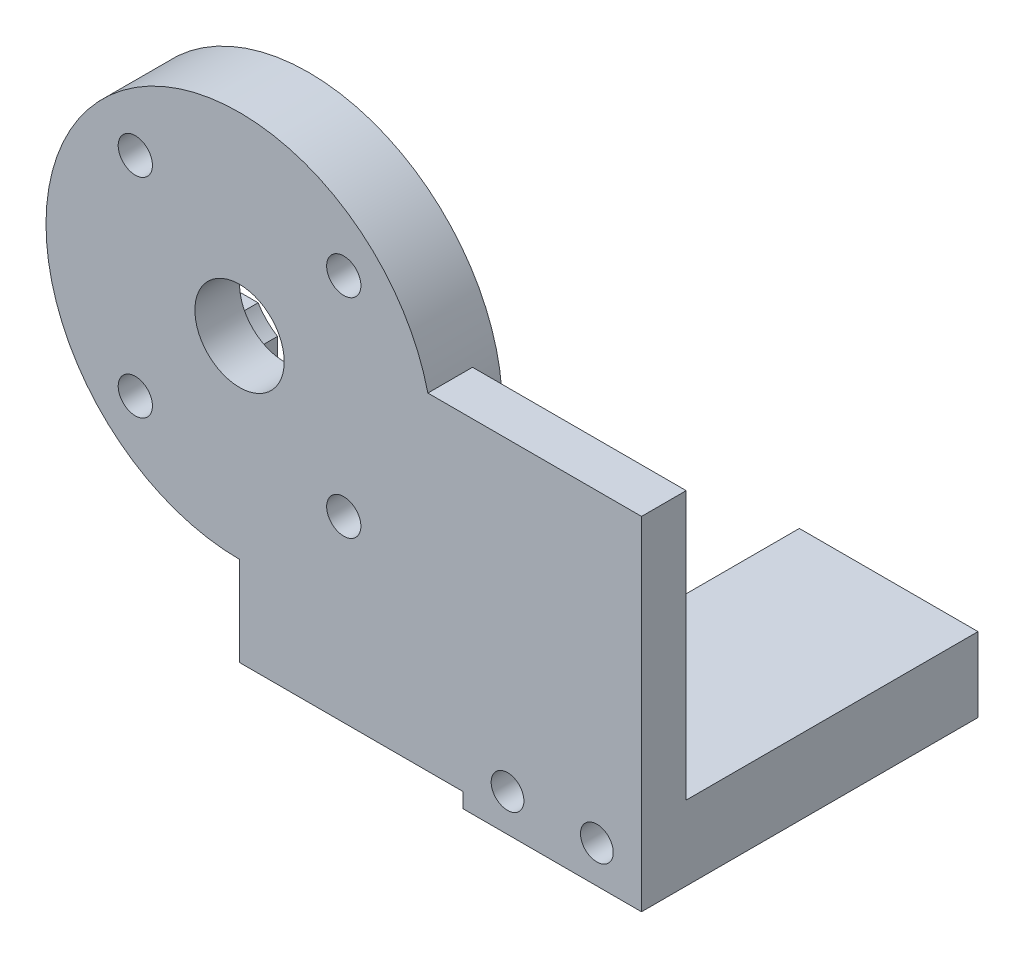
from build123d import *

# Parameters (mm, degrees)
STOCK_HORN_ATTACHMENT_START          = 19.6
STOCK_HORN_ATTACHMENT_PROFILE_R      = 13
STOCK_HORN_ATTACHMENT_DEPTH          = 3
FINGER_ARM_START                     = 19.6
FINGER_ARM_PROFILE_W                 = 27
FINGER_ARM_PROFILE_H                 = 22
FINGER_ARM_DEPTH                     = 3
DESCENDING_CONTACT_FINGER_PROFILE_W  = 12
DESCENDING_CONTACT_FINGER_PROFILE_H  = 5
DESCENDING_CONTACT_FINGER_DEPTH      = 22.6
HORN_CENTER_ACCESS_START             = -50
HORN_CENTER_ACCESS_PROFILE_R         = 3
HORN_CENTER_ACCESS_DEPTH             = 91.493950165
CAPTURED_HORN_KEY_BOSS_START         = 17.95
CAPTURED_HORN_KEY_BOSS_PROFILE_R     = 13
CAPTURED_HORN_KEY_BOSS_DEPTH         = 1.65
KEY_POCKET_HUB_START                 = 17.95
STOCK_HORN_POCKET_HUB_R              = 3.55
KEY_POCKET_HUB_DEPTH                 = 1.65
KEY_POCKET_HORIZONTAL_START          = 17.95
STOCK_HORN_POCKET_HORIZONTAL_W       = 16.3
STOCK_HORN_POCKET_HORIZONTAL_H       = 4.2
KEY_POCKET_HORIZONTAL_DEPTH          = 1.65
KEY_POCKET_VERTICAL_START            = 17.95
STOCK_HORN_POCKET_VERTICAL_W         = 4.2
STOCK_HORN_POCKET_VERTICAL_H         = 16.3
KEY_POCKET_VERTICAL_DEPTH            = 1.65
KEY_POCKET_ROUNDED_TIPS_START        = 17.95
STOCK_HORN_POCKET_ROUNDED_TIPS_R     = 2.1
KEY_POCKET_ROUNDED_TIPS_DEPTH        = 1.65
UNMODIFIED_HORN_CAPTURE_M2_START     = -50
UNMODIFIED_HORN_CAPTURE_M2_PROFILE_R = 1.15
UNMODIFIED_HORN_CAPTURE_M2_DEPTH     = 91.493950165
HUB_CLEARANCE_IN_KEY_BOSS_ONLY_START = 17.95
HORN_CENTER_HUB_CLEARANCE_R          = 4
HUB_CLEARANCE_IN_KEY_BOSS_ONLY_DEPTH = 1.65
CONTACT_PAD_KEEPER_START             = -50
CONTACT_PAD_KEEPER_PROFILE_R         = 1.1
CONTACT_PAD_KEEPER_DEPTH             = 91.493950165


with BuildPart() as part:
    # Stock_horn_attachment_profile → Stock_horn_attachment (new body)
    with BuildSketch(Plane.XY.offset(STOCK_HORN_ATTACHMENT_START)):
        Circle(STOCK_HORN_ATTACHMENT_PROFILE_R)
    extrude(amount=STOCK_HORN_ATTACHMENT_DEPTH)

    # Finger_arm_profile → Finger_arm (add)
    with BuildSketch(Plane.XY.offset(FINGER_ARM_START)):
        with Locations((13.5, -8)):
            Rectangle(FINGER_ARM_PROFILE_W, FINGER_ARM_PROFILE_H)
    extrude(amount=FINGER_ARM_DEPTH)

    # Descending_contact_finger_profile → Descending_contact_finger (add)
    with BuildSketch(Plane.XY):
        with Locations((21, -17.5)):
            Rectangle(DESCENDING_CONTACT_FINGER_PROFILE_W, DESCENDING_CONTACT_FINGER_PROFILE_H)
    extrude(amount=DESCENDING_CONTACT_FINGER_DEPTH)

    # Horn_center_access_profile → Horn_center_access (cut, through all)
    with BuildSketch(Plane.XY.offset(HORN_CENTER_ACCESS_START)):
        Circle(HORN_CENTER_ACCESS_PROFILE_R)
    extrude(amount=HORN_CENTER_ACCESS_DEPTH, mode=Mode.SUBTRACT)

    # Captured_horn_key_boss_profile → Captured_horn_key_boss (add)
    with BuildSketch(Plane.XY.offset(CAPTURED_HORN_KEY_BOSS_START)):
        with Locations(Location((0, 0, 0), (0, 0, 270))):
            Circle(CAPTURED_HORN_KEY_BOSS_PROFILE_R)
    extrude(amount=CAPTURED_HORN_KEY_BOSS_DEPTH)

    # Stock_horn_pocket_Hub → Key_pocket_Hub (cut)
    with BuildSketch(Plane.XY.offset(KEY_POCKET_HUB_START)):
        Circle(STOCK_HORN_POCKET_HUB_R)
    extrude(amount=KEY_POCKET_HUB_DEPTH, mode=Mode.SUBTRACT)

    # Stock_horn_pocket_Horizontal → Key_pocket_Horizontal (cut)
    with BuildSketch(Plane.XY.offset(KEY_POCKET_HORIZONTAL_START)):
        Rectangle(STOCK_HORN_POCKET_HORIZONTAL_W, STOCK_HORN_POCKET_HORIZONTAL_H)
    extrude(amount=KEY_POCKET_HORIZONTAL_DEPTH, mode=Mode.SUBTRACT)

    # Stock_horn_pocket_Vertical → Key_pocket_Vertical (cut)
    with BuildSketch(Plane.XY.offset(KEY_POCKET_VERTICAL_START)):
        Rectangle(STOCK_HORN_POCKET_VERTICAL_W, STOCK_HORN_POCKET_VERTICAL_H)
    extrude(amount=KEY_POCKET_VERTICAL_DEPTH, mode=Mode.SUBTRACT)

    # Stock_horn_pocket_Rounded_tips → Key_pocket_Rounded_tips (cut)
    with BuildSketch(Plane.XY.offset(KEY_POCKET_ROUNDED_TIPS_START)):
        with Locations((8.15, 0)):
            Circle(STOCK_HORN_POCKET_ROUNDED_TIPS_R)
        with Locations((-8.15, 0)):
            Circle(STOCK_HORN_POCKET_ROUNDED_TIPS_R)
        with Locations((0, 8.15)):
            Circle(STOCK_HORN_POCKET_ROUNDED_TIPS_R)
        with Locations((0, -8.15)):
            Circle(STOCK_HORN_POCKET_ROUNDED_TIPS_R)
    extrude(amount=KEY_POCKET_ROUNDED_TIPS_DEPTH, mode=Mode.SUBTRACT)

    # Unmodified_horn_capture_M2_profile → Unmodified_horn_capture_M2 (cut, through all)
    with BuildSketch(Plane.XY.offset(UNMODIFIED_HORN_CAPTURE_M2_START)):
        with Locations((7, 7)):
            Circle(UNMODIFIED_HORN_CAPTURE_M2_PROFILE_R)
        with Locations((-7, 7)):
            Circle(UNMODIFIED_HORN_CAPTURE_M2_PROFILE_R)
        with Locations((-7, -7)):
            Circle(UNMODIFIED_HORN_CAPTURE_M2_PROFILE_R)
        with Locations((7, -7)):
            Circle(UNMODIFIED_HORN_CAPTURE_M2_PROFILE_R)
    extrude(amount=UNMODIFIED_HORN_CAPTURE_M2_DEPTH, mode=Mode.SUBTRACT)

    # Horn_center_hub_clearance → Hub_clearance_in_key_boss_only (cut)
    with BuildSketch(Plane.XY.offset(HUB_CLEARANCE_IN_KEY_BOSS_ONLY_START)):
        Circle(HORN_CENTER_HUB_CLEARANCE_R)
    extrude(amount=HUB_CLEARANCE_IN_KEY_BOSS_ONLY_DEPTH, mode=Mode.SUBTRACT)

    # Contact_pad_keeper_profile → Contact_pad_keeper (cut, through all)
    with BuildSketch(Plane.XY.offset(CONTACT_PAD_KEEPER_START)):
        with Locations(Location((18, -17.5, 0), (0, 0, 180))):
            Circle(CONTACT_PAD_KEEPER_PROFILE_R)
        with Locations(Location((24, -17.5, 0), (0, 0, 180))):
            Circle(CONTACT_PAD_KEEPER_PROFILE_R)
    extrude(amount=CONTACT_PAD_KEEPER_DEPTH, mode=Mode.SUBTRACT)


solid = part.part
